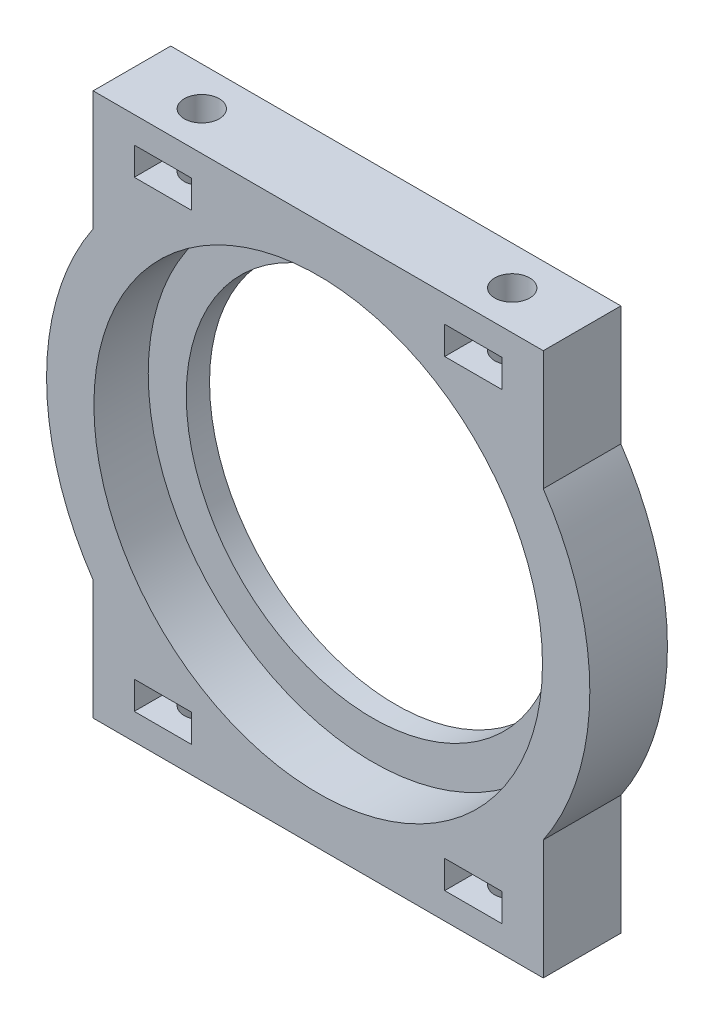
from build123d import *

# Parameters (mm, degrees)
CROQUIS1_R              = 28.9
SALIENTE_EXTRUIR1_DEPTH = 5
CROQUIS2_R              = 28.9
CROQUIS2_R_2            = 24
SALIENTE_EXTRUIR2_DEPTH = 3
CORTAR_EXTRUIR1_DEPTH   = 3.6
CROQUIS6_R              = 2.25
CORTAR_EXTRUIR2_DEPTH   = 10


with BuildPart() as part:
    # Croquis1 → Saliente-Extruir1 (new, symmetric)
    with BuildSketch(Plane.XY):
        with BuildLine():
            Line((-29, 19.595917942), (-29, 35))
            Line((-29, 35), (29, 35))
            Line((29, 35), (29, 19.595917942))
            ThreePointArc((29, 19.595917942), (35, 0), (29, -19.595917942))
            Line((29, -19.595917942), (29, -35))
            Line((29, -35), (-29, -35))
            Line((-29, -35), (-29, -19.595917942))
            ThreePointArc((-29, -19.595917942), (-35, 0), (-29, 19.595917942))
        make_face()
        Circle(CROQUIS1_R, mode=Mode.SUBTRACT)
    extrude(amount=SALIENTE_EXTRUIR1_DEPTH, both=True)

    # Croquis2 → Saliente-Extruir2 (add)
    with BuildSketch(Plane(origin=(0, 0, -5), x_dir=(-1, 0, 0), z_dir=(0, 0, -1))):
        Circle(CROQUIS2_R)
        Circle(CROQUIS2_R_2, mode=Mode.SUBTRACT)
    extrude(amount=-SALIENTE_EXTRUIR2_DEPTH)

    # Croquis5 → Cortar-Extruir1 (cut)
    with BuildSketch(Plane(origin=(0, 28, 0), x_dir=(1, 0, 0), z_dir=(0, 1, 0))):
        Polygon((-23.7, -2.136195996), (-23.7, -5), (-16.3, -5), (-16.3, -2.136195996), (-16.3, 2.136195996), (-20, 4.272391992), (-23.7, 2.136195996), align=None)
        Polygon((16.3, 2.136195996), (16.3, -2.136195996), (16.3, -5), (23.7, -5), (23.7, -2.136195996), (23.7, 2.136195996), (20, 4.272391992), align=None)
    cortar_extruir1 = extrude(amount=CORTAR_EXTRUIR1_DEPTH, mode=Mode.SUBTRACT)

    # Croquis6 → Cortar-Extruir2 (cut)
    with BuildSketch(Plane(origin=(0, 35, 0), x_dir=(1, 0, 0), z_dir=(0, 1, 0))):
        with Locations(Location((-20, 0, 0), (0, 0, 270))):
            Circle(CROQUIS6_R)
        with Locations(Location((20, 0, 0), (0, 0, 270))):
            Circle(CROQUIS6_R)
    cortar_extruir2 = extrude(amount=-CORTAR_EXTRUIR2_DEPTH, mode=Mode.SUBTRACT)

    # Simetría1: Cortar-Extruir1, Cortar-Extruir2 across plane
    add(cortar_extruir1.mirror(Plane.ZX), mode=Mode.SUBTRACT)
    add(cortar_extruir2.mirror(Plane.ZX), mode=Mode.SUBTRACT)


solid = part.part
